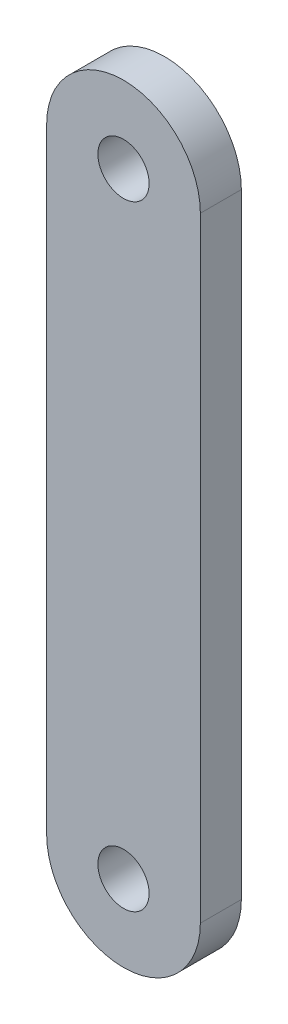
from build123d import *

# Parameters (mm, degrees)
SKETCH1_R           = 1.5875
BOSS_EXTRUDE1_DEPTH = 2.54


with BuildPart() as part:
    # Sketch1 → Boss-Extrude1 (new body)
    with BuildSketch(Plane.XY):
        with BuildLine():
            Line((-4.7625, -19.05), (-4.7625, 19.05))
            ThreePointArc((-4.7625, 19.05), (0, 23.8125), (4.7625, 19.05))
            Line((4.7625, 19.05), (4.7625, -19.05))
            ThreePointArc((4.7625, -19.05), (0, -23.8125), (-4.7625, -19.05))
        make_face()
        with Locations((0, 19.05)):
            Circle(SKETCH1_R, mode=Mode.SUBTRACT)
        with Locations((0, -19.05)):
            Circle(SKETCH1_R, mode=Mode.SUBTRACT)
    extrude(amount=BOSS_EXTRUDE1_DEPTH)


solid = part.part
